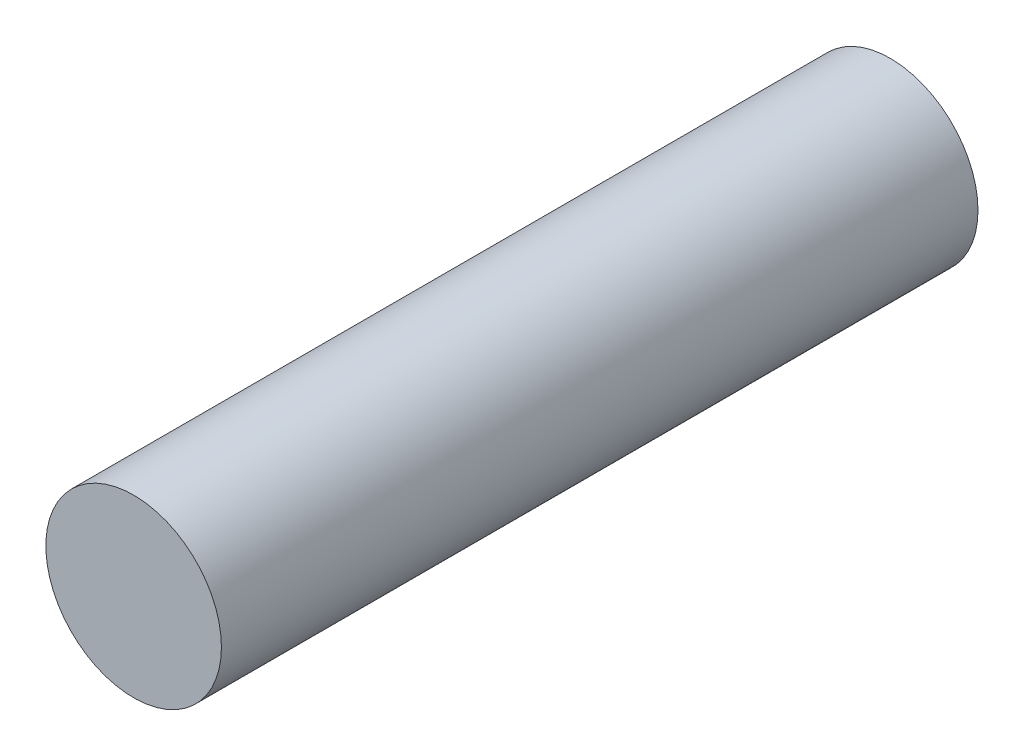
from build123d import *

# Parameters (mm, degrees)
SKETCH1_R                = 2
BOSS_EXTRUDE1_DEPTH      = 6.35
CUT_EXTRUDE1_DEPTH       = 93.473426076
CUT_EXTRUDE1_DEPTH_BACK  = 93.473426076
SKETCH2_R                = 7
BOSS_EXTRUDE2_DEPTH      = 47.625
BOSS_EXTRUDE2_DEPTH_BACK = 12.7
SKETCH5_R                = 7
SKETCH6_R                = 7
BOSS_EXTRUDE3_DEPTH      = 6.35
FILLET1_R                = 6.35
FILLET2_R                = 3.175
SKETCH7_R                = 10.175
SKETCH7_R_2              = 7
BOSS_EXTRUDE4_DEPTH      = 3.175


with BuildPart() as part:
    # Sketch1 → Boss-Extrude1 (new, symmetric)
    # profile 1 of 3: a face of its own
    with BuildSketch(Plane.XY):
        Polygon((22.188571811, 51.670547503), (22.188571811, 37.229452497), (13.9055, 25.4), (13.9055, 0), (52.0055, 0), (52.0055, 25.4), (26.6055, 76.2), (13.9055, 76.2), (13.9055, 63.5), align=None)
        with Locations((33.493, 8.8)):
            Circle(SKETCH1_R, mode=Mode.SUBTRACT)
        with Locations((17.493, 8.8)):
            Circle(SKETCH1_R, mode=Mode.SUBTRACT)
    # profile 2 of 3: a face of its own
    with BuildSketch(Plane.XY):
        with Locations((17.493, 8.8)):
            Circle(SKETCH1_R)
    # profile 3 of 3: a face of its own
    with BuildSketch(Plane.XY):
        with Locations((33.493, 8.8)):
            Circle(SKETCH1_R)
    extrude(amount=BOSS_EXTRUDE1_DEPTH, both=True)

    # Sketch2 → Cut-Extrude1 (cut, two sides: drawn at the far end of the back side and taken through both)
    with BuildSketch(Plane.XY.offset(-CUT_EXTRUDE1_DEPTH_BACK)):
        with Locations((25.493, 16.8)):
            Circle(SKETCH2_R)
    extrude(amount=CUT_EXTRUDE1_DEPTH + CUT_EXTRUDE1_DEPTH_BACK, mode=Mode.SUBTRACT)

    # Fillet2
    fillet2_edges = [part.edges().sort_by_distance(p)[0] for p in [
        (22.188571811, 51.670547503, 0),
        (13.9055, 63.5, 0),
        (13.9055, 76.2, 0),
        (26.6055, 76.2, 0),
        (52.0055, 25.4, 0),
        (52.0055, 0, 0),
        (13.9055, 0, 0),
        (13.9055, 25.4, 0),
        (22.188571811, 37.229452497, 0),
    ]]
    fillet(fillet2_edges, radius=FILLET2_R)


with BuildPart() as body_2:
    # Sketch5 → Boss-Extrude2 (new, two sides: drawn at the far end of the back side and taken through both)
    with BuildSketch(Plane.XY.offset(6.35).offset(-BOSS_EXTRUDE2_DEPTH_BACK)):
        with Locations((25.493, 16.8)):
            Circle(SKETCH5_R)
    extrude(amount=BOSS_EXTRUDE2_DEPTH + BOSS_EXTRUDE2_DEPTH_BACK)


with BuildPart() as body_3:
    # Sketch6 → Boss-Extrude3 (new, symmetric)
    # profile 1 of 2: a face of its own
    with BuildSketch(Plane.XY.offset(15.875)):
        Polygon((0, -22.225), (0, 0), (-14.3805, 0), (-14.3805, 30.15), (-36.6055, 30.15), (-36.6055, -22.225), (-14.3805, -22.225), align=None)
        with Locations((-25.493, 16.8)):
            Circle(SKETCH6_R, mode=Mode.SUBTRACT)
    # profile 2 of 2: a face of its own
    with BuildSketch(Plane.XY.offset(15.875)):
        Polygon((14.3805, 30.15), (14.3805, 0), (0, 0), (0, -22.225), (14.3805, -22.225), (36.6055, -22.225), (36.6055, 30.15), align=None)
        with Locations((25.493, 16.8)):
            Circle(SKETCH6_R, mode=Mode.SUBTRACT)
    extrude(amount=BOSS_EXTRUDE3_DEPTH, both=True)

    # Fillet1
    fillet1_edges = [body_3.edges().sort_by_distance(p)[0] for p in [
        (-14.3805, 0, 15.875),
        (14.3805, 0, 15.875),
        (14.3805, 30.15, 15.875),
        (36.6055, 30.15, 15.875),
        (36.6055, -22.225, 15.875),
        (-36.6055, -22.225, 15.875),
        (-36.6055, 30.15, 15.875),
        (-14.3805, 30.15, 15.875),
    ]]
    fillet(fillet1_edges, radius=FILLET1_R)


with BuildPart() as body_4:
    # Sketch7 → Boss-Extrude4 (new body)
    with BuildSketch(Plane.XY.offset(6.35)):
        with Locations((25.493, 16.8)):
            Circle(SKETCH7_R)
        with Locations((25.493, 16.8)):
            Circle(SKETCH7_R_2, mode=Mode.SUBTRACT)
    extrude(amount=BOSS_EXTRUDE4_DEPTH)


solid = body_2.part
